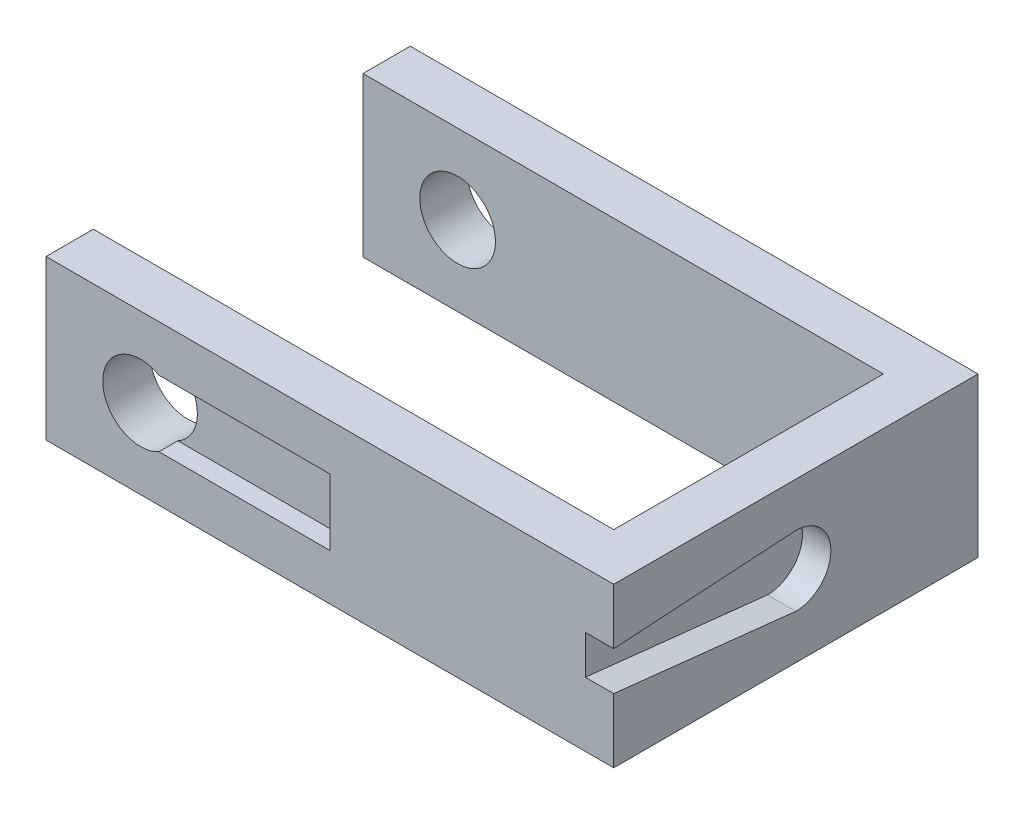
from build123d import *

# Parameters (mm, degrees)
BOSS_EXTRUDE2_DEPTH = 16.8
SKETCH5_R           = 4
CUT_EXTRUDE3_DEPTH  = 38.5
SKETCH6_W           = 20
SKETCH6_H           = 7
CUT_EXTRUDE4_DEPTH  = 2
SKETCH8_W           = 20
SKETCH8_H           = 7
CUT_EXTRUDE5_DEPTH  = 2
CUT_EXTRUDE8_DEPTH  = 3


with BuildPart() as part:
    # Sketch1 → Boss-Extrude2 (new body)
    with BuildSketch(Plane(origin=(0, 0, 0), x_dir=(1, 0, 0), z_dir=(0, 1, 0))):
        Polygon((2.5, -14.25), (-2.5, -14.25), (-57.5, -14.25), (-57.5, -19.25), (2.5, -19.25), align=None)
        Polygon((2.5, 14.25), (-2.5, 14.25), (-2.5, -0.75), (-2.5, -14.25), (2.5, -14.25), align=None)
        Polygon((-57.5, 14.25), (-2.5, 14.25), (2.5, 14.25), (2.5, 19.25), (-57.5, 19.25), align=None)
    extrude(amount=-BOSS_EXTRUDE2_DEPTH)

    # Sketch5 → Cut-Extrude3 (cut)
    with BuildSketch(Plane.XY.offset(19.25)):
        with Locations((-47.5, -8.4)):
            Circle(SKETCH5_R)
    extrude(amount=-CUT_EXTRUDE3_DEPTH, mode=Mode.SUBTRACT)

    # Sketch6 → Cut-Extrude4 (cut)
    with BuildSketch(Plane.XY.offset(19.25)):
        with Locations((-37.5, -8.4)):
            Rectangle(SKETCH6_W, SKETCH6_H)
    extrude(amount=-CUT_EXTRUDE4_DEPTH, mode=Mode.SUBTRACT)

    # Sketch8 → Cut-Extrude5 (cut)
    with BuildSketch(Plane(origin=(0, 0, -19.25), x_dir=(-1, 0, 0), z_dir=(0, 0, -1))):
        with Locations((37.5, -8.492973944)):
            Rectangle(SKETCH8_W, SKETCH8_H)
    extrude(amount=-CUT_EXTRUDE5_DEPTH, mode=Mode.SUBTRACT)

    # Sketch9 → Cut-Extrude8 (cut)
    with BuildSketch(Plane(origin=(2.5, 0, 0), x_dir=(0, 0, -1), z_dir=(1, 0, 0))):
        with BuildLine():
            Line((-19.25, -10.011044161), (-0.79368081, -12.013871992))
            ThreePointArc((-0.79368081, -12.013871992), (-3.696113756, -8.2304621), (-0.459513041, -4.728644969))
            Line((-0.459513041, -4.728644969), (-19.25, -5.9))
            Line((-19.25, -5.9), (-19.25, -10.011044161))
        make_face()
        with BuildLine():
            Line((-0.79368081, -12.013871992), (0, -12.1))
            ThreePointArc((0, -12.1), (2.61629509, -11.01629509), (3.7, -8.4))
            ThreePointArc((3.7, -8.4), (2.61629509, -5.78370491), (0, -4.7))
            Line((0, -4.7), (-0.459513041, -4.728644969))
            ThreePointArc((-0.459513041, -4.728644969), (-3.696113756, -8.2304621), (-0.79368081, -12.013871992))
        make_face()
    extrude(amount=-CUT_EXTRUDE8_DEPTH, mode=Mode.SUBTRACT)


solid = part.part
